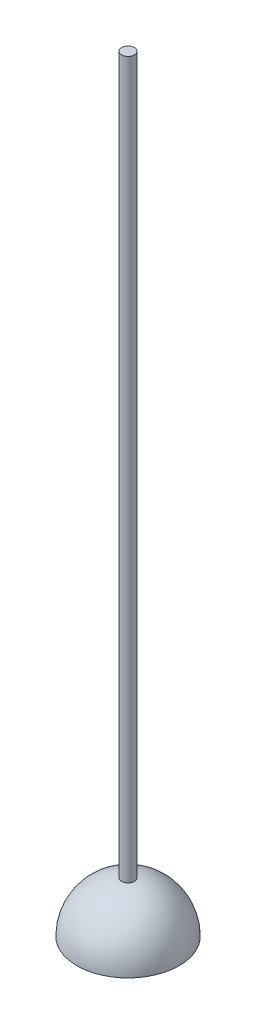
from build123d import *

# Parameters (mm, degrees)
SKETCH_3_R      = 12.5
EXTRUDE_1_DEPTH = 1500


with BuildPart() as part:
    # 草图2 → 旋转1 (revolve)
    with BuildSketch(Plane.XY, mode=Mode.PRIVATE) as revolve_1_sk:
        with BuildLine():
            Line((0, 0), (-100, 0))
            ThreePointArc((-100, 0), (-70.710678119, 70.710678119), (0, 100))
            Line((0, 100), (0, 0))
        make_face()
    revolve(revolve_1_sk.sketch.rotate(Axis((0, 0, 0), (0, 1, 0)), 180), axis=Axis((0, 0, 0), (0, 1, 0)))

    # 草图3 → 凸台-拉伸1 (add)
    with BuildSketch(Plane.XZ):
        with Locations(Location((0, 0, 0), (0, 0, 270))):
            Circle(SKETCH_3_R)
    extrude(amount=-EXTRUDE_1_DEPTH)


solid = part.part
